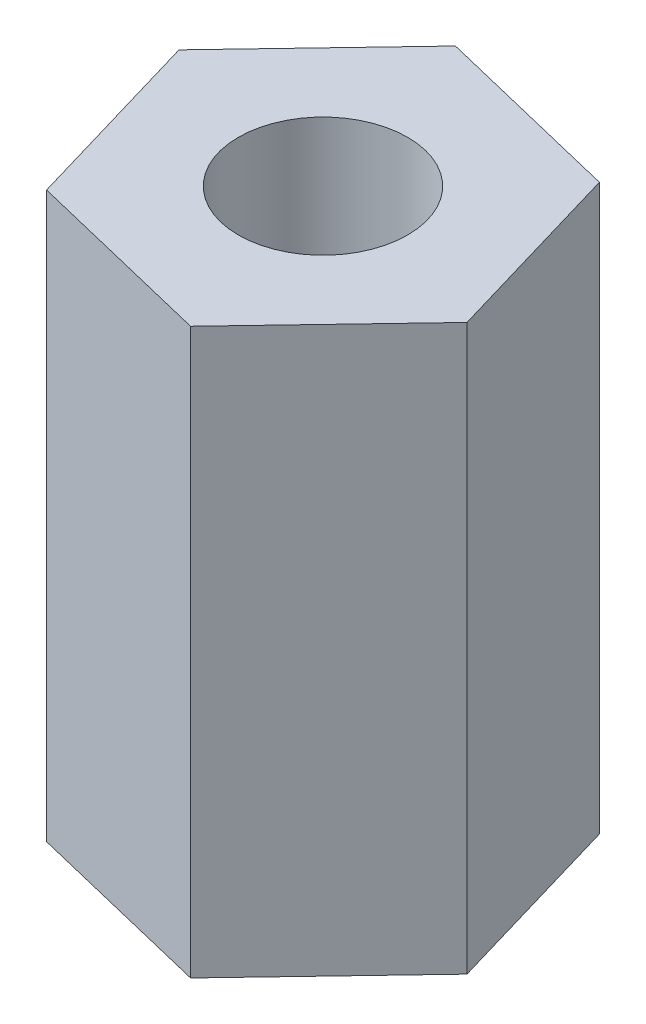
from build123d import *

# Parameters (mm, degrees)
SKETCH1_R           = 1.5
BOSS_EXTRUDE1_DEPTH = 5


with BuildPart() as part:
    # Sketch1 → Boss-Extrude1 (new, symmetric)
    with BuildSketch(Plane(origin=(0, 0, 0), x_dir=(1, 0, 0), z_dir=(0, 1, 0))):
        Polygon((0.977287067, -3.32338833), (3.366782253, -0.815338738), (2.389495187, 2.508049591), (-0.977287067, 3.32338833), (-3.366782253, 0.815338738), (-2.389495187, -2.508049591), align=None)
        with Locations(Location((0, 0, 0), (0, 0, 270))):
            Circle(SKETCH1_R, mode=Mode.SUBTRACT)
    extrude(amount=BOSS_EXTRUDE1_DEPTH, both=True)


solid = part.part
